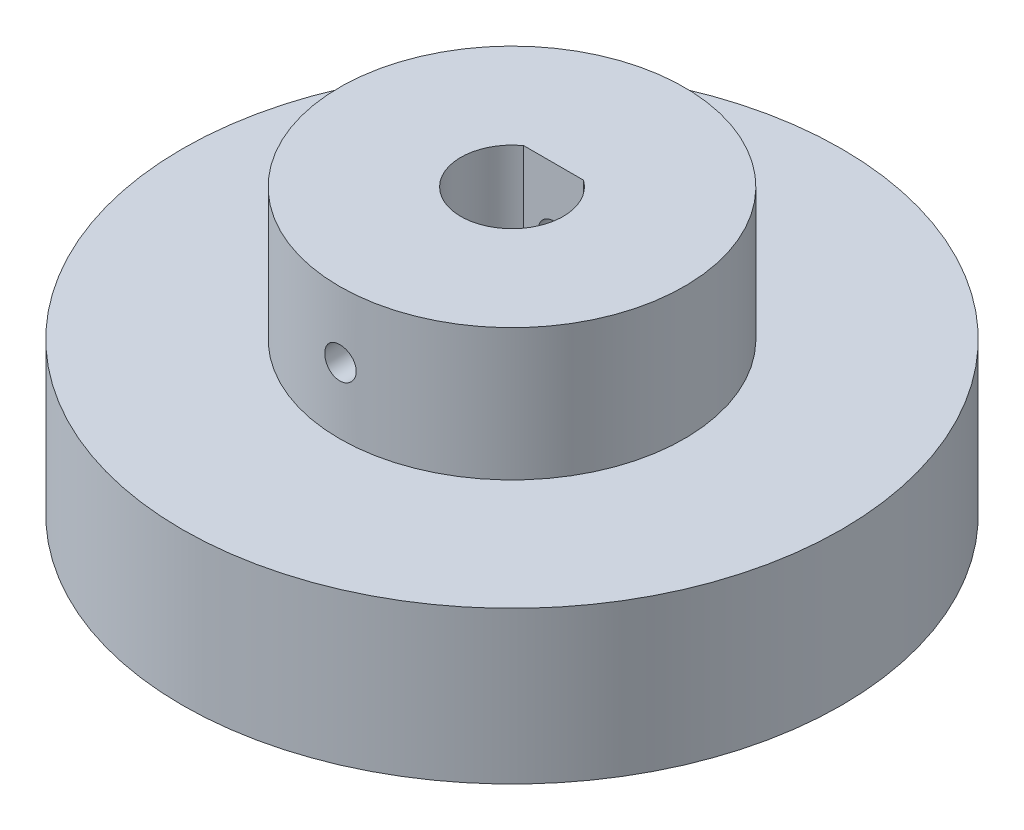
from build123d import *

# Parameters (mm, degrees)
SKETCH1_R               = 32.5
BOSS_EXTRUDE1_DEPTH     = 15
SKETCH2_R               = 17
BOSS_EXTRUDE2_DEPTH     = 13
CUT_EXTRUDE2_DEPTH      = 54.819141576
CUT_EXTRUDE2_DEPTH_BACK = 54.819141576
SKETCH3_R               = 1.55
CUT_EXTRUDE3_DEPTH      = 54.819141576


with BuildPart() as part:
    # Sketch1 → Boss-Extrude1 (new body)
    with BuildSketch(Plane(origin=(0, 0, 0), x_dir=(1, 0, 0), z_dir=(0, 1, 0))):
        with Locations(Location((0, 0, 0), (0, 0, 270))):
            Circle(SKETCH1_R)
    extrude(amount=BOSS_EXTRUDE1_DEPTH)

    # Sketch2 → Boss-Extrude2 (add)
    with BuildSketch(Plane(origin=(0, 15, 0), x_dir=(1, 0, 0), z_dir=(0, 1, 0))):
        with Locations(Location((0, 0, 0), (0, 0, 90))):
            Circle(SKETCH2_R)
    extrude(amount=BOSS_EXTRUDE2_DEPTH)

    # Sketch3 → Cut-Extrude2 (cut, two sides: drawn at the far end of the back side and taken through both)
    with BuildSketch(Plane.XY.offset(-CUT_EXTRUDE2_DEPTH_BACK)):
        with Locations((0.022370376, 21.5)):
            Circle(SKETCH3_R)
    extrude(amount=CUT_EXTRUDE2_DEPTH + CUT_EXTRUDE2_DEPTH_BACK, mode=Mode.SUBTRACT)

    # Sketch4 → Cut-Extrude3 (cut, through all)
    with BuildSketch(Plane(origin=(0, 28, 0), x_dir=(1, 0, 0), z_dir=(0, 1, 0))):
        with BuildLine():
            Line((-2.948304598, 4.1), (2.948304598, 4.1))
            ThreePointArc((2.948304598, 4.1), (0, -5.05), (-2.948304598, 4.1))
        make_face()
    extrude(amount=-CUT_EXTRUDE3_DEPTH, mode=Mode.SUBTRACT)


solid = part.part
